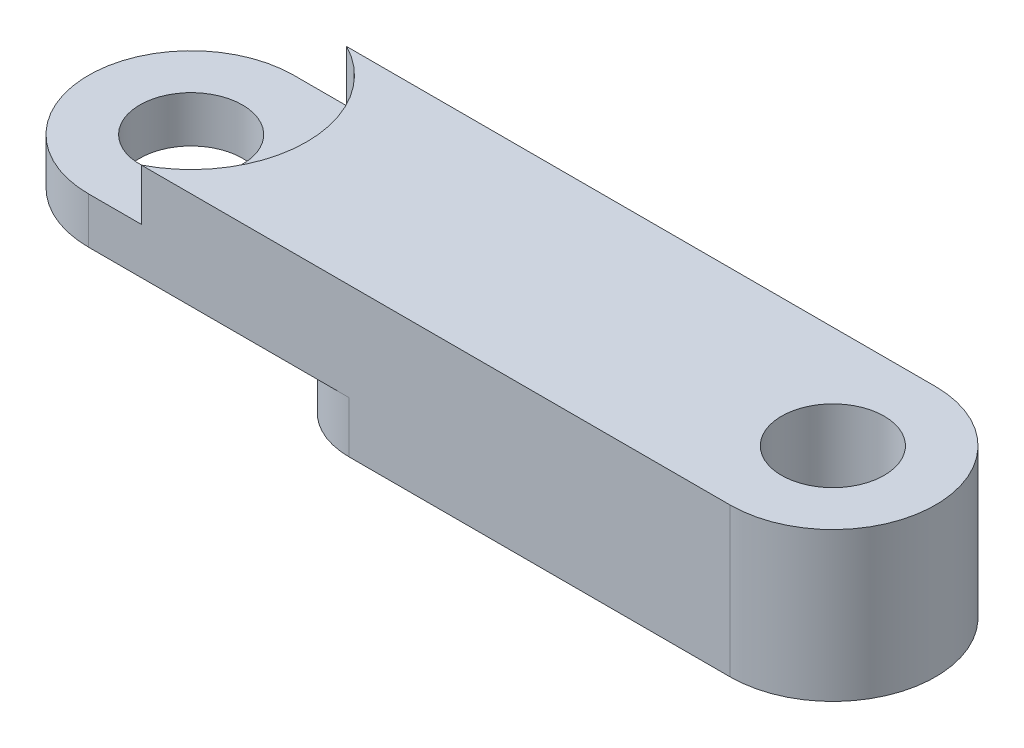
from build123d import *

# Parameters (mm, degrees)
SKETCH1_R           = 20
BOSS_EXTRUDE1_DEPTH = 58
SKETCH3_R           = 45
CUT_EXTRUDE2_DEPTH  = 20
CUT_EXTRUDE3_START  = -20
SKETCH4_R           = 45
CUT_EXTRUDE3_DEPTH  = 20
SKETCH6_W           = 142.996364582
SKETCH6_H           = 80
CUT_EXTRUDE6_DEPTH  = 20
FILLET1_R           = 30


with BuildPart() as part:
    # Sketch1 → Boss-Extrude1 (new body)
    with BuildSketch(Plane(origin=(0, 0, 0), x_dir=(1, 0, 0), z_dir=(0, 1, 0))):
        with BuildLine():
            Line((-125, 40), (125.000000012, 40))
            ThreePointArc((125.000000012, 40), (165, -6e-09), (125, -40))
            Line((125, -40), (-125, -40))
            ThreePointArc((-125, -40), (-165, 0), (-125, 40))
        make_face()
        with Locations(Location((-125, 0, 0), (0, 0, 90))):
            Circle(SKETCH1_R, mode=Mode.SUBTRACT)
        with Locations(Location((125, 0, 0), (0, 0, 90))):
            Circle(SKETCH1_R, mode=Mode.SUBTRACT)
    extrude(amount=BOSS_EXTRUDE1_DEPTH)

    # Sketch3 → Cut-Extrude2 (cut)
    with BuildSketch(Plane(origin=(0, 58, 0), x_dir=(1, 0, 0), z_dir=(0, 1, 0))):
        with Locations((-125, 0)):
            Circle(SKETCH3_R)
    extrude(amount=-CUT_EXTRUDE2_DEPTH, mode=Mode.SUBTRACT)

    # Sketch4 → Cut-Extrude3 (cut)
    with BuildSketch(Plane.XZ.offset(CUT_EXTRUDE3_START)):
        with Locations((-125, 0)):
            Circle(SKETCH4_R)
    extrude(amount=CUT_EXTRUDE3_DEPTH, mode=Mode.SUBTRACT)

    # Sketch6 → Cut-Extrude6 (cut)
    with BuildSketch(Plane.XZ):
        with Locations((-125, 0)):
            Rectangle(SKETCH6_W, SKETCH6_H)
    extrude(amount=-CUT_EXTRUDE6_DEPTH, mode=Mode.SUBTRACT)

    # Fillet1
    fillet1_edges = [part.edges().sort_by_distance(p)[0] for p in [
        (-53.501817709, 10, -40),
        (-53.501817709, 10, 40),
    ]]
    fillet(fillet1_edges, radius=FILLET1_R)


solid = part.part
